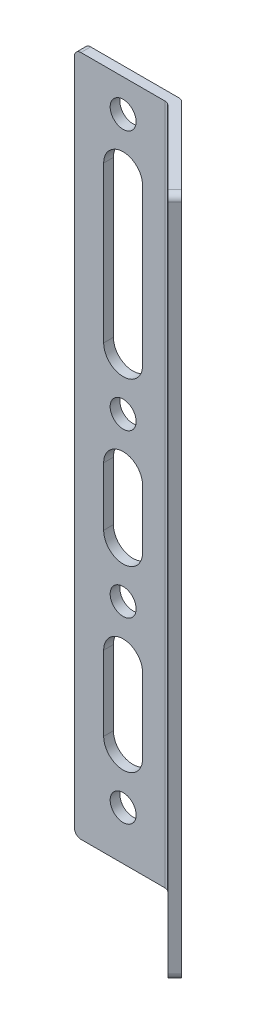
from build123d import *

# Parameters (mm, degrees)
EXTRUDE_1_DEPTH     = 105
SKETCH_2_R          = 2
CUT_EXTRUDE_1_DEPTH = 107.775508677
SKETCH_3_R          = 2
CUT_EXTRUDE_2_DEPTH = 110.207453302
FILLET_1_R          = 1


with BuildPart() as part:
    # 草图1 → 拉伸-薄壁1 (new body)
    with BuildSketch(Plane(origin=(0, 0, 0), x_dir=(1, 0, 0), z_dir=(0, 1, 0))):
        Polygon((-15, 0), (0, 0), (12.727922061, -12.727922061), (11.66726189, -13.788582233), (-0.621320344, -1.5), (-15, -1.5), align=None)
    extrude(amount=EXTRUDE_1_DEPTH)

    # 草图2 → 切除-拉伸1 (cut, through all)
    with BuildSketch(Plane.XY.offset(1.5)):
        with Locations((-7.5, 100)):
            Circle(SKETCH_2_R)
        with Locations((-7.5, 60)):
            Circle(SKETCH_2_R)
        with Locations((-7.5, 35)):
            Circle(SKETCH_2_R)
        with Locations((-7.5, 7.5)):
            Circle(SKETCH_2_R)
        with BuildLine():
            Line((-4.5, 92), (-4.5, 68))
            ThreePointArc((-4.5, 68), (-7.5, 65), (-10.5, 68))
            Line((-10.5, 68), (-10.5, 92))
            ThreePointArc((-10.5, 92), (-7.5, 95), (-4.5, 92))
        make_face()
        with BuildLine():
            Line((-4.5, 52), (-4.5, 43))
            ThreePointArc((-4.5, 43), (-7.5, 40), (-10.5, 43))
            Line((-10.5, 43), (-10.5, 52))
            ThreePointArc((-10.5, 52), (-7.5, 55), (-4.5, 52))
        make_face()
        with BuildLine():
            Line((-4.5, 27), (-4.5, 15.5))
            ThreePointArc((-4.5, 15.5), (-7.5, 12.5), (-10.5, 15.5))
            Line((-10.5, 15.5), (-10.5, 27))
            ThreePointArc((-10.5, 27), (-7.5, 30), (-4.5, 27))
        make_face()
    extrude(amount=-CUT_EXTRUDE_1_DEPTH, mode=Mode.SUBTRACT)

    # 草图3 → 切除-拉伸2 (cut, through all)
    with BuildSketch(Plane(origin=(11.66726189, 0, 13.788582233), x_dir=(0.7071067811865562, 0, 0.7071067811865389), z_dir=(-0.7071067811865389, 0, 0.7071067811865562))):
        with BuildLine():
            Line((-4.5, 68), (-4.5, 92))
            ThreePointArc((-4.5, 92), (-7.5, 95), (-10.5, 92))
            Line((-10.5, 92), (-10.5, 68))
            ThreePointArc((-10.5, 68), (-7.5, 65), (-4.5, 68))
        make_face()
        with BuildLine():
            Line((-4.5, 43), (-4.5, 52))
            ThreePointArc((-4.5, 52), (-7.5, 55), (-10.5, 52))
            Line((-10.5, 52), (-10.5, 43))
            ThreePointArc((-10.5, 43), (-7.5, 40), (-4.5, 43))
        make_face()
        with BuildLine():
            Line((-4.5, 15.5), (-4.5, 27))
            ThreePointArc((-4.5, 27), (-7.5, 30), (-10.5, 27))
            Line((-10.5, 27), (-10.5, 15.5))
            ThreePointArc((-10.5, 15.5), (-7.5, 12.5), (-4.5, 15.5))
        make_face()
        with Locations((-7.5, 100)):
            Circle(SKETCH_3_R)
        with Locations((-7.5, 60)):
            Circle(SKETCH_3_R)
        with Locations((-7.5, 35)):
            Circle(SKETCH_3_R)
        with Locations((-7.5, 7.5)):
            Circle(SKETCH_3_R)
    extrude(amount=-CUT_EXTRUDE_2_DEPTH, mode=Mode.SUBTRACT)

    # 圆角1
    fillet_1_edges = [part.edges().sort_by_distance(p)[0] for p in [
        (-15, 105, 0.75),
        (-15, 0, 0.75),
        (12.197591975, 0, 13.258252147),
        (12.197591975, 105, 13.258252147),
        (-0.621320344, 52.5, 1.5),
        (0, 52.5, 0),
    ]]
    fillet(fillet_1_edges, radius=FILLET_1_R)


solid = part.part
